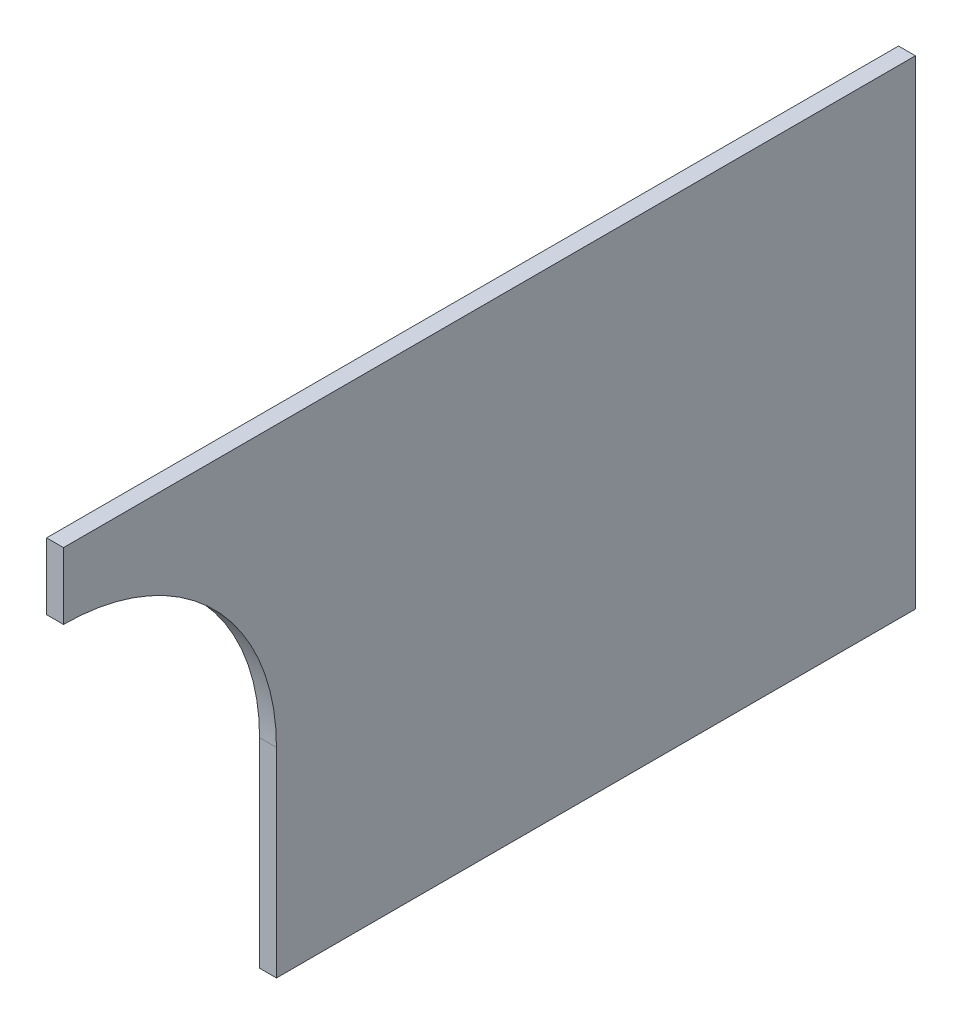
from build123d import *

# Parameters (mm, degrees)
BOSS_EXTRUDE1_DEPTH = 6.35


with BuildPart() as part:
    # Sketch1 → Boss-Extrude1 (new body)
    with BuildSketch(Plane(origin=(0, 0, 0), x_dir=(0, 0, -1), z_dir=(1, 0, 0))):
        with BuildLine():
            Line((0, 0), (0, 75))
            ThreePointArc((0, 75), (-23.431457505, 131.568542495), (-80, 155))
            Line((-80, 155), (-80, 180))
            Line((-80, 180), (240, 180))
            Line((240, 180), (240, 0))
            Line((240, 0), (0, 0))
        make_face()
    extrude(amount=BOSS_EXTRUDE1_DEPTH)


solid = part.part
